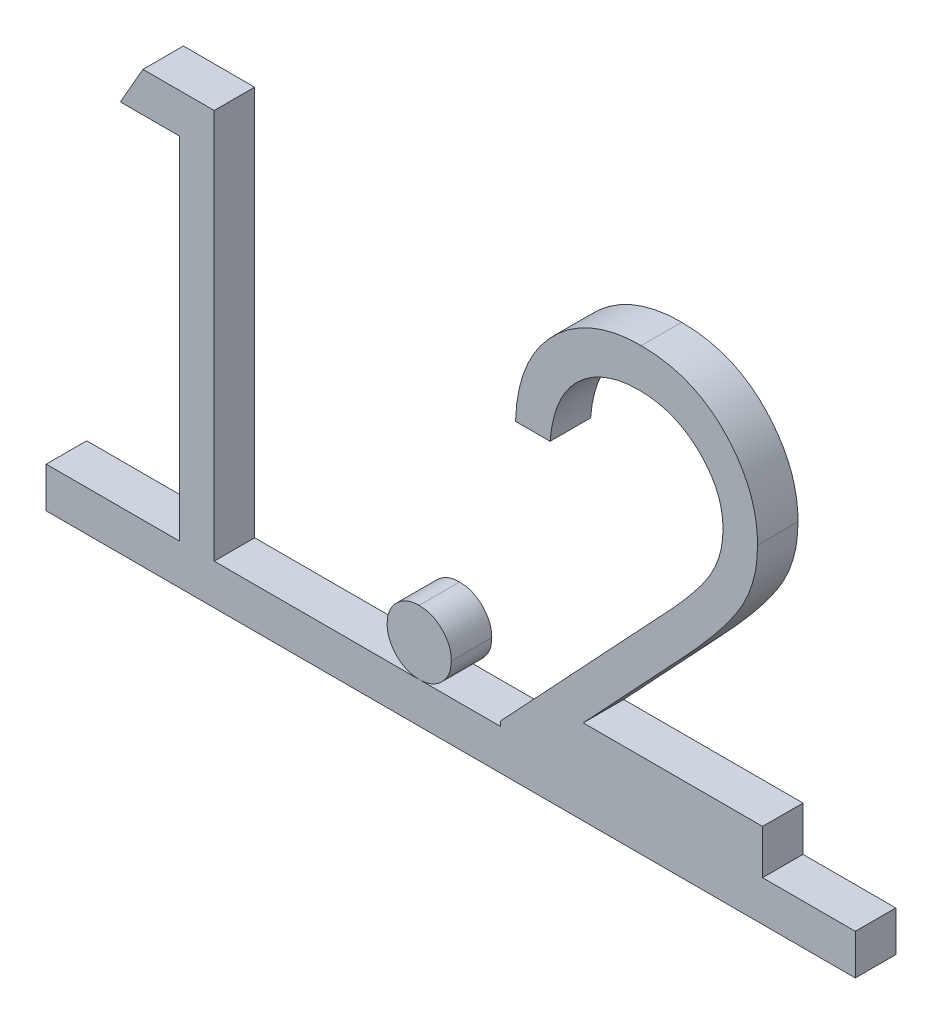
from build123d import *

# Parameters (mm, degrees)
RESSALTO_EXTRUS_O1_DEPTH   = 2
RESSALTO_EXTRUS_O1_2_DEPTH = 2
RESSALTO_EXTRUS_O1_3_DEPTH = 2
ESBO_O2_W                  = 2
ESBO_O2_H                  = 2
RESSALTO_EXTRUS_O2_DEPTH   = 40
ESBO_O3_W                  = 1.709615385
ESBO_O3_H                  = 2
ESBO_O3_W_2                = 12.944230769
RESSALTO_EXTRUS_O3_DEPTH   = 0.244230769


with BuildPart() as part:
    # Esboço1 → Ressalto-extrusão1 (new body)
    with BuildSketch(Plane.XY):
        Polygon((4.781580529, 19.05), (8.303846154, 19.05), (8.303846154, 0), (6.594230769, 0), (6.594230769, 17.096153846), (3.663461538, 17.096153846), align=None)
    extrude(amount=RESSALTO_EXTRUS_O1_DEPTH)



with BuildPart() as body_2:
    # Esboço1 → Ressalto-extrus_o1 2 (new body)
    with BuildSketch(Plane.XY):
        with BuildLine():
            add(Edge.make_bspline(
                [(18.439423077, 2.930769231), (18.545505517, 2.924465495), (18.75346774, 2.912107758), (19.054126424, 2.827326148), (19.326240215, 2.67678401), (19.568622862, 2.476145174), (19.76841097, 2.232873064), (19.924318086, 1.962929618), (20.008361163, 1.659753807), (20.020628883, 1.450586576), (20.026923077, 1.343269231)],
                knots=[0, 0, 0, 0, 1.020151414, 1.999887582, 2.974338812, 3.990962822, 5.007586832, 5.987933904, 6.967670073, 8, 8, 8, 8], degree=3))
            add(Edge.make_bspline(
                [(20.026923077, 1.343269231), (20.020415593, 1.238530536), (20.00758293, 1.031987368), (19.924510734, 0.731098264), (19.767222775, 0.460986113), (19.570000885, 0.214413047), (19.326180297, 0.013349165), (19.053483104, -0.135912183), (18.754173542, -0.226764245), (18.545623268, -0.238337376), (18.439423077, -0.244230769)],
                knots=[0, 0, 0, 0, 1.009421747, 1.99056486, 2.972319754, 3.999869655, 5.017953583, 5.993804169, 6.978383603, 8, 8, 8, 8], degree=3))
            add(Edge.make_bspline(
                [(18.439423077, -0.244230769), (18.333146362, -0.238550619), (18.125666375, -0.227461478), (17.827474035, -0.134046775), (17.553116106, 0.011949487), (17.309342989, 0.214787952), (17.110469308, 0.459717304), (16.960108296, 0.73295851), (16.869810485, 1.031126048), (16.857934864, 1.23836089), (16.851923077, 1.343269231)],
                knots=[0, 0, 0, 0, 1.022052826, 1.995314843, 2.982371812, 4.00089066, 5.028879526, 6.005146991, 6.990147033, 8, 8, 8, 8], degree=3))
            add(Edge.make_bspline(
                [(16.851923077, 1.343269231), (16.857703931, 1.450762283), (16.86899034, 1.660629275), (16.960297863, 1.961070131), (17.109302673, 2.234129779), (17.310717752, 2.475774022), (17.553057134, 2.678179198), (17.826812193, 2.825489001), (18.126384548, 2.912794673), (18.333267213, 2.9246738), (18.439423077, 2.930769231)],
                knots=[0, 0, 0, 0, 1.032775665, 2.016367738, 2.991239715, 4.008302682, 5.025365648, 6.011011707, 6.979408107, 8, 8, 8, 8], degree=3))
        make_face()
    extrude(amount=RESSALTO_EXTRUS_O1_2_DEPTH)


with BuildPart() as body_3:
    # Esboço1 → Ressalto-extrus_o1 3 (new body)
    with BuildSketch(Plane.XY):
        with BuildLine():
            Line((24.911538462, 13.188461538), (23.201923077, 13.188461538))
            add(Edge.make_bspline(
                [(23.201923077, 13.188461538), (23.213065438, 13.415270228), (23.234948739, 13.860716457), (23.337428428, 14.510179433), (23.484063774, 15.130963409), (23.691390117, 15.718083941), (23.948871429, 16.276732306), (24.257644863, 16.804689534), (24.623371393, 17.299941576), (25.038153759, 17.75789728), (25.488651638, 18.178018201), (25.974731108, 18.540813165), (26.485516185, 18.847342205), (27.0194572, 19.103598679), (27.582578267, 19.295948411), (28.16976925, 19.43866905), (28.783609978, 19.524537446), (29.201839241, 19.533767365), (29.414543269, 19.538461538)],
                knots=[0, 0, 0, 0, 1.10065271, 2.161652631, 3.183658789, 4.190468796, 5.17591951, 6.163126047, 7.15150782, 8.156236427, 9.156009102, 10.134482811, 11.092018607, 12.041330605, 13.001268258, 13.972401359, 14.968799086, 16, 16, 16, 16], degree=3))
            add(Edge.make_bspline(
                [(29.414543269, 19.538461538), (29.623429644, 19.533571368), (30.033883908, 19.523962359), (30.63293573, 19.441443042), (31.203223575, 19.312199179), (31.743632705, 19.130868128), (32.249851428, 18.887112887), (32.72568257, 18.59430057), (33.176790983, 18.255646916), (33.582865048, 17.856936874), (33.955744737, 17.431292467), (34.277429868, 16.976879735), (34.552910087, 16.507546051), (34.782531601, 16.019712554), (34.951565729, 15.508785956), (35.079898547, 14.982204753), (35.152437756, 14.434518281), (35.163570704, 14.063824029), (35.169230769, 13.875360577)],
                knots=[0, 0, 0, 0, 1.111607364, 2.184268762, 3.212621178, 4.221274766, 5.211760367, 6.196651075, 7.1921475, 8.207485113, 9.220403448, 10.201281604, 11.166441695, 12.114753415, 13.065576456, 14.026450734, 14.996634279, 16, 16, 16, 16], degree=3))
            add(Edge.make_bspline(
                [(35.169230769, 13.875360577), (35.160014581, 13.610033077), (35.141743937, 13.0840342), (34.985455687, 12.31106759), (34.741362534, 11.562166266), (34.447462635, 10.95943895), (34.150976903, 10.473753792), (33.883800612, 10.073874126), (33.571027855, 9.643314363), (33.208106316, 9.183516283), (32.802543397, 8.690878357), (32.350665623, 8.165698185), (31.84925067, 7.613401838), (31.497323688, 7.23618135), (31.314963942, 7.040715144)],
                knots=[0, 0, 0, 0, 1.184426356, 2.348067706, 3.509069118, 4.696110526, 5.333549288, 6.050745305, 6.844228056, 7.710549037, 8.667450064, 9.695053472, 10.805634456, 12, 12, 12, 12], degree=3))
            Line((31.314963942, 7.040715144), (26.548647837, 1.953846154))
            Line((26.548647837, 1.953846154), (35.413461538, 1.953846154))
            Line((35.413461538, 1.953846154), (35.413461538, 0))
            Line((35.413461538, 0), (22.469230769, 0))
            Line((22.469230769, 0), (29.857211538, 7.884074519))
            add(Edge.make_bspline(
                [(29.857211538, 7.884074519), (30.037086465, 8.071843873), (30.382589387, 8.432510375), (30.871263127, 8.959068486), (31.31016962, 9.447562415), (31.702150001, 9.8970692), (32.038700937, 10.314163877), (32.337362657, 10.685337906), (32.576661088, 11.026901414), (32.83636917, 11.422818184), (33.087905269, 11.906210939), (33.304053949, 12.496944305), (33.43585191, 13.10505978), (33.451662515, 13.516006582), (33.459615385, 13.722716346)],
                knots=[0, 0, 0, 0, 1.329631726, 2.553950428, 3.673215718, 4.687767853, 5.603093632, 6.413772471, 7.123043292, 7.734684054, 8.834405432, 9.900288307, 10.943827018, 12, 12, 12, 12], degree=3))
            add(Edge.make_bspline(
                [(33.459615385, 13.722716346), (33.45615513, 13.852699386), (33.449335633, 14.108870997), (33.389150165, 14.484459486), (33.298197268, 14.846762258), (33.167866649, 15.196893742), (32.995835678, 15.531333648), (32.786430567, 15.850489076), (32.544821793, 16.159039015), (32.26532417, 16.448344823), (31.958284327, 16.71330967), (31.63392134, 16.948027907), (31.290748629, 17.144183638), (30.930213107, 17.304984673), (30.55331991, 17.431124962), (30.159340083, 17.518529516), (29.749362222, 17.573407036), (29.469417053, 17.580832028), (29.326772837, 17.584615385)],
                knots=[0, 0, 0, 0, 0.991446411, 1.95395049, 2.89581595, 3.838931463, 4.798493298, 5.75982156, 6.748411868, 7.785213223, 8.824556874, 9.840280684, 10.836137867, 11.835679398, 12.848801643, 13.863922112, 14.911575587, 16, 16, 16, 16], degree=3))
            add(Edge.make_bspline(
                [(29.326772837, 17.584615385), (29.177797304, 17.580723566), (28.885233956, 17.573080677), (28.455688934, 17.51961732), (28.045919202, 17.427383532), (27.654893987, 17.301236204), (27.28195167, 17.140897531), (26.928905945, 16.941189607), (26.596549362, 16.702882308), (26.284257142, 16.432695852), (25.996526056, 16.131882194), (25.743722346, 15.796547966), (25.522829355, 15.432815891), (25.330101955, 15.041667409), (25.173588842, 14.619553263), (25.053992123, 14.167971898), (24.959358, 13.688884094), (24.927743052, 13.35803956), (24.911538462, 13.188461538)],
                knots=[0, 0, 0, 0, 1.031018746, 2.02475058, 2.990194455, 3.934040569, 4.864654155, 5.795059489, 6.735614925, 7.690564532, 8.649604399, 9.611025574, 10.590972636, 11.591080095, 12.624614302, 13.701020113, 14.821632451, 16, 16, 16, 16], degree=3))
        make_face()
    extrude(amount=RESSALTO_EXTRUS_O1_3_DEPTH)


with BuildPart() as body_4:
    # Esboço2 → Ressalto-extrusão2 (new body)
    with BuildSketch(Plane(origin=(0, 0, 0), x_dir=(0, 0, -1), z_dir=(1, 0, 0))):
        with Locations((-1, -1.244230769)):
            Rectangle(ESBO_O2_W, ESBO_O2_H)
    extrude(amount=RESSALTO_EXTRUS_O2_DEPTH)


with BuildPart() as part_1:
    add(part.part)

    add(body_3.part)  # Ressalto-extrusão3 merges body 3

    add(body_4.part)  # Ressalto-extrusão3 merges body 4
    # Esboço3 → Ressalto-extrusão3 (add)
    with BuildSketch(Plane.XZ):
        with Locations((7.449038462, 1)):
            Rectangle(ESBO_O3_W, ESBO_O3_H)
        with Locations((28.941346153, 1)):
            Rectangle(ESBO_O3_W_2, ESBO_O3_H)
    extrude(amount=RESSALTO_EXTRUS_O3_DEPTH)


solid = Compound([body_2.part, part_1.part])
